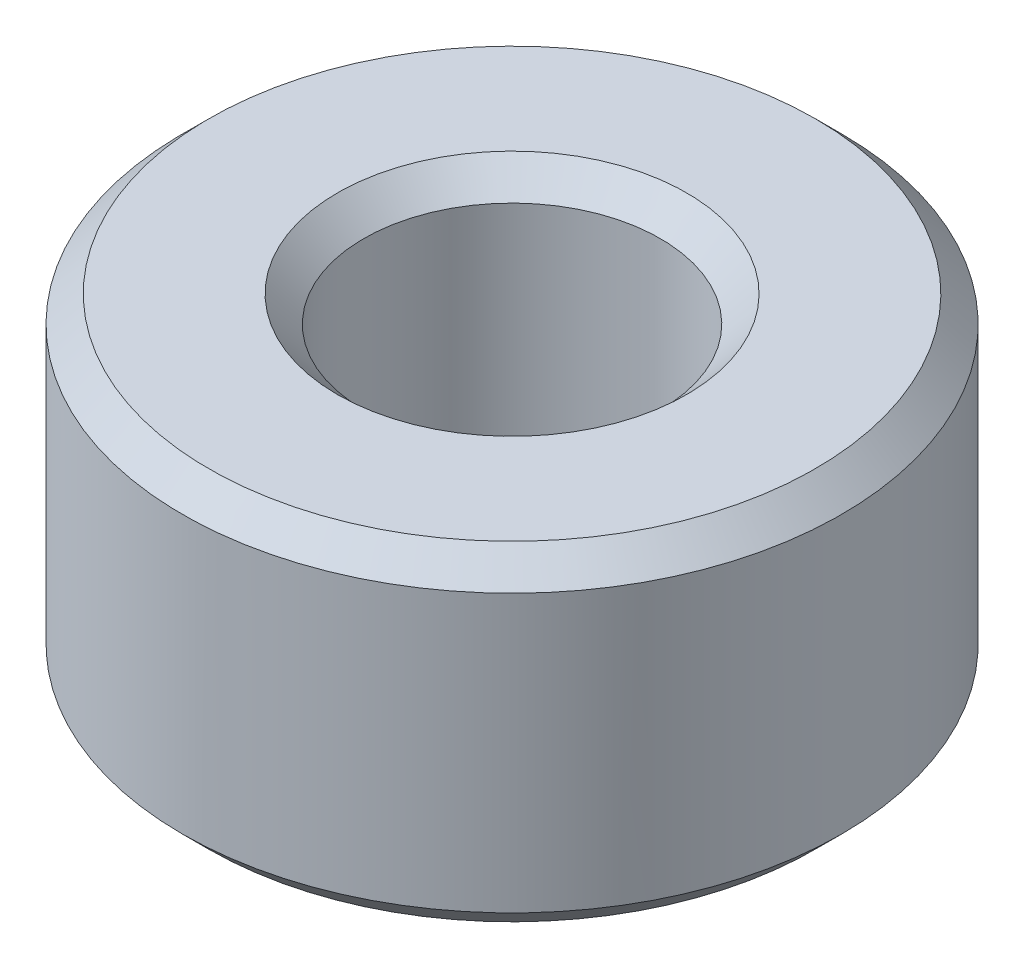
from build123d import *

# Parameters (mm, degrees)
BODY_SKETCH_R   = 5
BODY_SKETCH_R_2 = 2.25
BODY_DEPTH      = 5
CHAMFERS_SIZE   = 0.4


with BuildPart() as part:
    # body_sketch → body (new body)
    with BuildSketch(Plane(origin=(0, 0, 0), x_dir=(1, 0, 0), z_dir=(0, 1, 0))):
        with Locations(Location((0, 0, 0), (0, 0, 270))):
            Circle(BODY_SKETCH_R)
        with Locations(Location((0, 0, 0), (0, 0, 270))):
            Circle(BODY_SKETCH_R_2, mode=Mode.SUBTRACT)
    extrude(amount=BODY_DEPTH)

    # chamfers
    chamfers_edges = [part.edges().sort_by_distance(p)[0] for p in [
        (0, 0, -5),
        (0, 5, -5),
        (0, 0, -2.25),
        (0, 5, -2.25),
    ]]
    chamfer(chamfers_edges, length=CHAMFERS_SIZE)


solid = part.part
